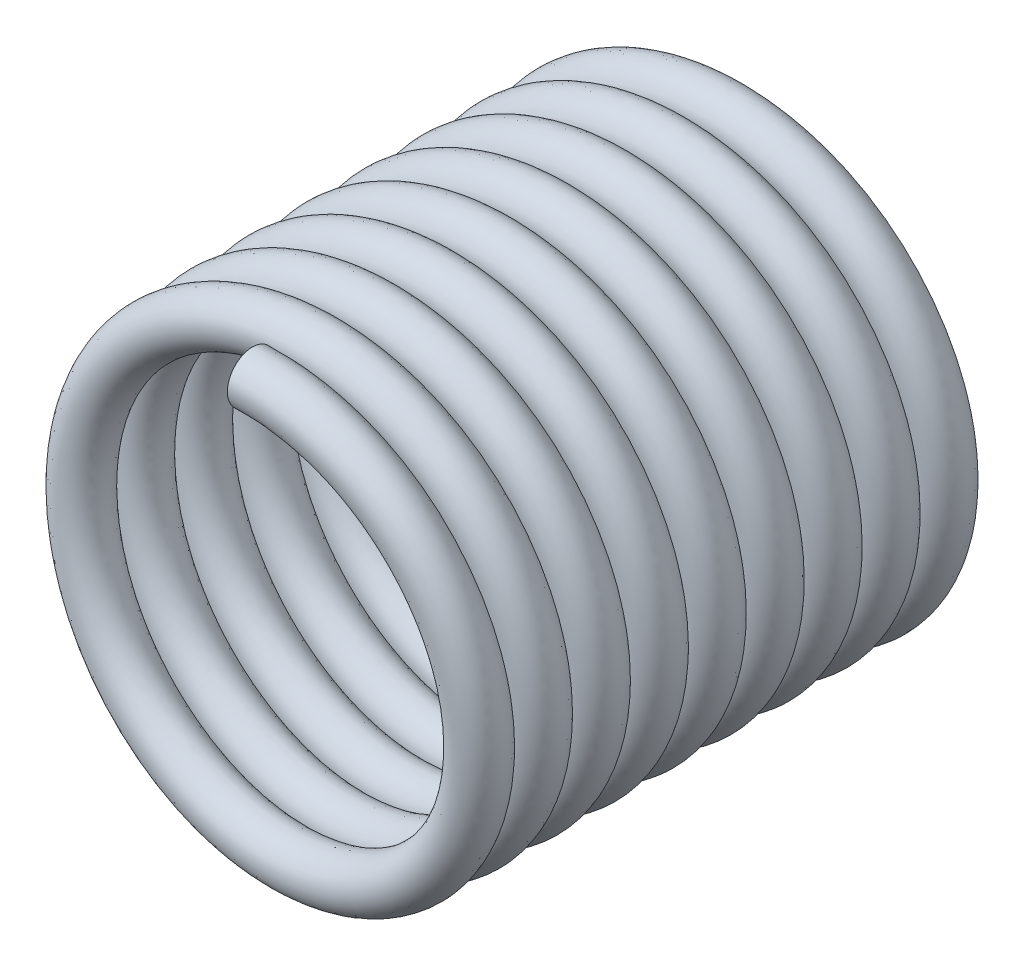
from build123d import *

# Parameters (mm, degrees)
SWEEP1_PITCH       = 1.143725714
SWEEP1_HEIGHT      = 10.0076
SWEEP1_RADIUS      = 4.0005
SWEEP1_START_ANGLE = -180
SKETCH2_R          = 0.4953


with BuildPart() as part:
    # Sweep1: sweep along a helix
    with BuildLine() as sweep1_path:
        add(Helix(SWEEP1_PITCH, SWEEP1_HEIGHT, SWEEP1_RADIUS, center=(0, 0, 0), direction=(0, 0, 1), mode=Mode.PRIVATE).rotate(Axis((0, 0, 0), (0, 0, 1)), SWEEP1_START_ANGLE))
    # Sketch2 → Sweep1 (sweep)
    with BuildSketch(Plane(origin=(0, 4.0005, 10.0076), x_dir=(0.04544954106397384, -0.015039595718082556, 0.9988534175632133), z_dir=(-0.9989664017777142, -1.297879989245465e-13, 0.04545468203922036))):
        with Locations((0.001589314, 0.206647084)):
            Circle(SKETCH2_R)
    sweep(path=sweep1_path.line, is_frenet=True)


solid = part.part
